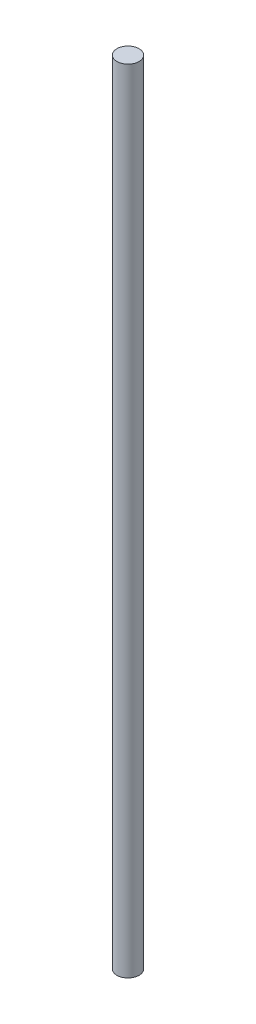
from build123d import *

# Parameters (mm, degrees)
SKETCH1_R           = 4
BOSS_EXTRUDE1_DEPTH = 285


with BuildPart() as part:
    # Sketch1 → Boss-Extrude1 (new body)
    with BuildSketch(Plane(origin=(0, 0, 0), x_dir=(1, 0, 0), z_dir=(0, 1, 0))):
        with Locations(Location((0, 0, 0), (0, 0, 270))):
            Circle(SKETCH1_R)
    extrude(amount=BOSS_EXTRUDE1_DEPTH)


solid = part.part
